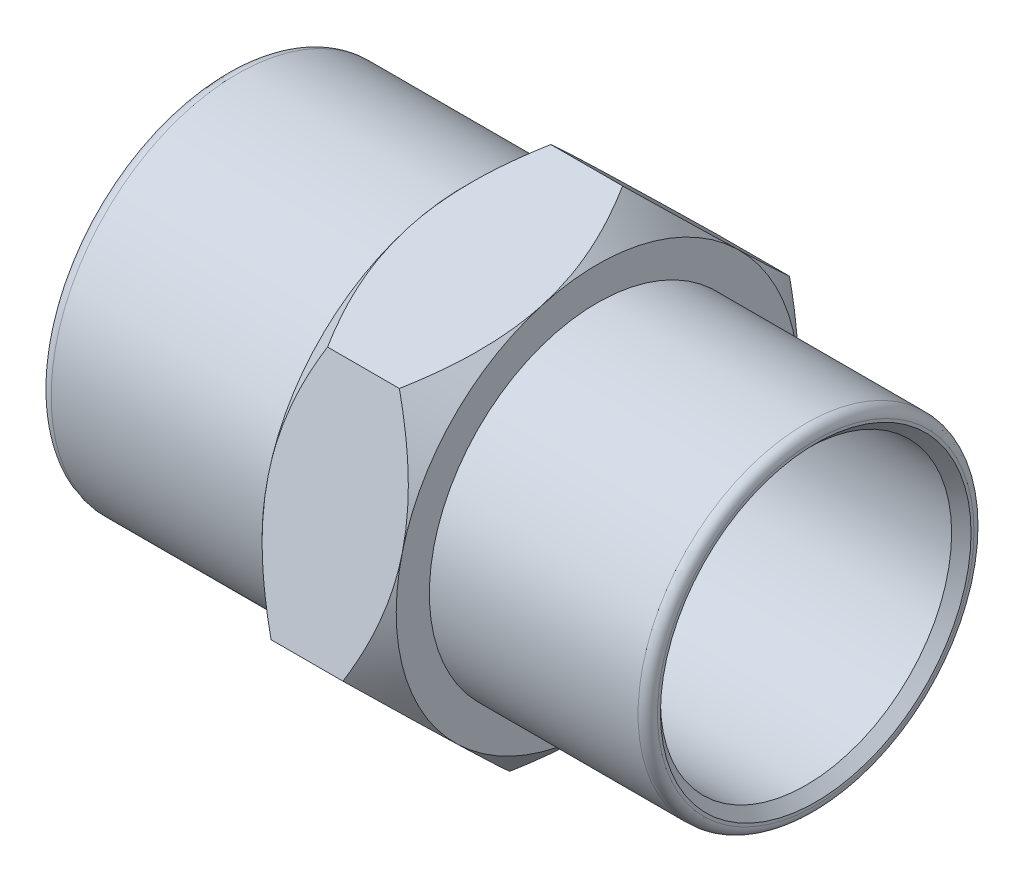
from build123d import *

# Parameters (mm, degrees)
SKETCH_1_R          = 25
EXTRUDE_1_DEPTH     = 50
SKETCH_2_R          = 20
CUT_EXTRUDE_1_DEPTH = 48
EXTRUDE_2_DEPTH     = 18
SKETCH_4_OUTSIDE_W  = 101.712
SKETCH_4_OUTSIDE_H  = 102.234
SKETCH_4_OUTSIDE_R  = 27
CUT_EXTRUDE_3_DEPTH = 10
CUT_EXTRUDE_3_DRAFT = -45
SKETCH_5_OUTSIDE_W  = 101.712
SKETCH_5_OUTSIDE_H  = 102.234
SKETCH_5_OUTSIDE_R  = 27
CUT_EXTRUDE_4_DEPTH = 10
CUT_EXTRUDE_4_DRAFT = -45
SKETCH_6_R          = 22.55
SKETCH_6_R_2        = 19.55
EXTRUDE_1_2_DEPTH   = 29.325
FILLET_1_R          = 1.666666667
CHAMFER_1_SIZE      = 1.303333333
FILLET_2_R          = 1.303333333


with BuildPart() as part:
    # Эскиз1 → Extrude 1 (new body)
    with BuildSketch(Plane(origin=(0, 0, 0), x_dir=(0, 0, -1), z_dir=(1, 0, 0))):
        Circle(SKETCH_1_R)
    extrude(amount=-EXTRUDE_1_DEPTH)

    # Эскиз2 → Вырез-Вытянуть1 (cut)
    with BuildSketch(Plane.ZY.offset(50)):
        Circle(SKETCH_2_R)
    extrude(amount=-CUT_EXTRUDE_1_DEPTH, mode=Mode.SUBTRACT)

    # Эскиз3 → Бобышка-Вытянуть2 (add)
    with BuildSketch(Plane(origin=(0, 0, 0), x_dir=(0, 0, -1), z_dir=(1, 0, 0))):
        Polygon((22.398442547, -21.686626558), (29.980390795, 8.554306971), (7.581948249, 30.24093353), (-22.398442547, 21.686626558), (-29.980390795, -8.554306971), (-7.581948249, -30.24093353), align=None)
    extrude(amount=-EXTRUDE_2_DEPTH)


with BuildPart() as cut_extrude_3_tool:
    # Эскиз4 outside → Вырез-Вытянуть3 (with draft: the straight prism first)
    with BuildSketch(Plane(origin=(0, 0, 0), x_dir=(0, 0, -1), z_dir=(1, 0, 0))):
        Rectangle(SKETCH_4_OUTSIDE_W, SKETCH_4_OUTSIDE_H)
        Circle(SKETCH_4_OUTSIDE_R, mode=Mode.SUBTRACT)
    extrude(amount=-CUT_EXTRUDE_3_DEPTH)
    # Вырез-Вытянуть3: the draft: its side faces are tilted about the plane it starts from
    cut_extrude_3_sides = [cut_extrude_3_tool.faces().sort_by_distance(p)[0] for p in [
        (-5, -51.117, 0),
        (-5, 0, -50.856),
        (-5, 51.117, 0),
        (-5, 0, 50.856),
        (-5, 0, 27),
    ]]
    draft(cut_extrude_3_sides, Plane(origin=(0, 0, 0), x_dir=(0, 0, -1), z_dir=(1, 0, 0)), CUT_EXTRUDE_3_DRAFT)


with BuildPart() as part_1:
    add(part.part)

    # Вырез-Вытянуть3: cut by cut_extrude_3_tool
    add(cut_extrude_3_tool.part, mode=Mode.SUBTRACT)


with BuildPart() as cut_extrude_4_tool:
    # Эскиз5 outside → Вырез-Вытянуть4 (with draft: the straight prism first)
    with BuildSketch(Plane.ZY.offset(18)):
        Rectangle(SKETCH_5_OUTSIDE_W, SKETCH_5_OUTSIDE_H)
        Circle(SKETCH_5_OUTSIDE_R, mode=Mode.SUBTRACT)
    extrude(amount=-CUT_EXTRUDE_4_DEPTH)
    # Вырез-Вытянуть4: the draft: its side faces are tilted about the plane it starts from
    cut_extrude_4_sides = [cut_extrude_4_tool.faces().sort_by_distance(p)[0] for p in [
        (-13, -51.117, 0),
        (-13, 0, 50.856),
        (-13, 51.117, 0),
        (-13, 0, -50.856),
        (-13, 0, -27),
    ]]
    draft(cut_extrude_4_sides, Plane.ZY.offset(18), CUT_EXTRUDE_4_DRAFT)


with BuildPart() as part_2:
    add(part_1.part)

    # Вырез-Вытянуть4: cut by cut_extrude_4_tool
    add(cut_extrude_4_tool.part, mode=Mode.SUBTRACT)

    # Эскиз6 → Extrude 1 2 (add)
    with BuildSketch(Plane(origin=(0, 0, 0), x_dir=(0, 0, -1), z_dir=(1, 0, 0))):
        Circle(SKETCH_6_R)
        Circle(SKETCH_6_R_2, mode=Mode.SUBTRACT)
    extrude(amount=EXTRUDE_1_2_DEPTH)

    # Скругление1
    fillet_1_edges = [part_2.edges().sort_by_distance(p)[0] for p in [
        (-50, 0, 25),
        (-50, 0, -20),
    ]]
    fillet(fillet_1_edges, radius=FILLET_1_R)

    # Фаска1
    chamfer_1_edges = [part_2.edges().sort_by_distance(p)[0] for p in [
        (29.325, 0, 19.55),
    ]]
    chamfer(chamfer_1_edges, length=CHAMFER_1_SIZE)

    # Скругление2
    fillet_2_edges = [part_2.edges().sort_by_distance(p)[0] for p in [
        (29.325, 0, 22.55),
    ]]
    fillet(fillet_2_edges, radius=FILLET_2_R)


solid = part_2.part
